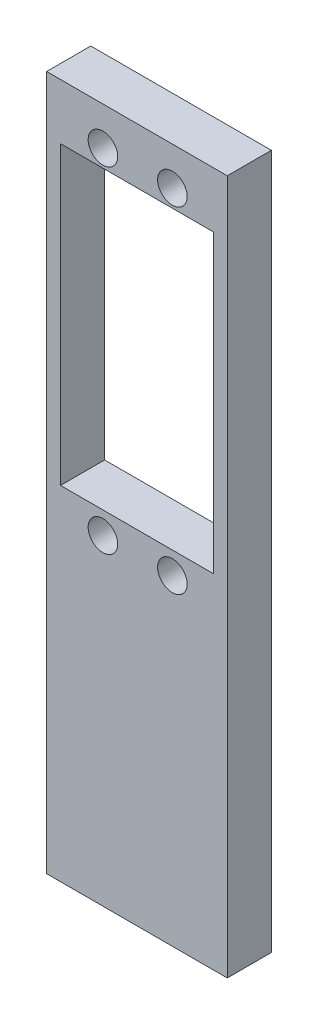
from build123d import *

# Parameters (mm, degrees)
SKETCH1_W           = 26
SKETCH1_H           = 100
BOSS_EXTRUDE1_DEPTH = 6.35
SKETCH2_W           = 22
SKETCH2_H           = 42.6
CUT_EXTRUDE1_DEPTH  = 84.596948906
HOLE1_D             = 4.25


with BuildPart() as part:
    # Sketch1 → Boss-Extrude1 (new body)
    with BuildSketch(Plane(origin=(0, 0, 7.302957559), x_dir=(-1, 0, 0), z_dir=(0, 0, -1))):
        with Locations((14.325270249, 28.74932998)):
            Rectangle(SKETCH1_W, SKETCH1_H)
    extrude(amount=BOSS_EXTRUDE1_DEPTH)

    # Sketch2 → Cut-Extrude1 (cut, through all)
    with BuildSketch(Plane(origin=(0, 0, 0.952957559), x_dir=(-1, 0, 0), z_dir=(0, 0, -1))):
        with Locations((14.325270249, 49.44932998)):
            Rectangle(SKETCH2_W, SKETCH2_H)
    extrude(amount=-CUT_EXTRUDE1_DEPTH, mode=Mode.SUBTRACT)

    # Hole1 (through all)
    with Locations(Plane.XY.offset(7.302957559)):
        with Locations((-19.225270249, 73.24932998), (-9.225270249, 73.24932998), (-19.225270249, 24.94932998), (-9.225270249, 24.94932998)):
            Hole(HOLE1_D / 2)


solid = part.part
